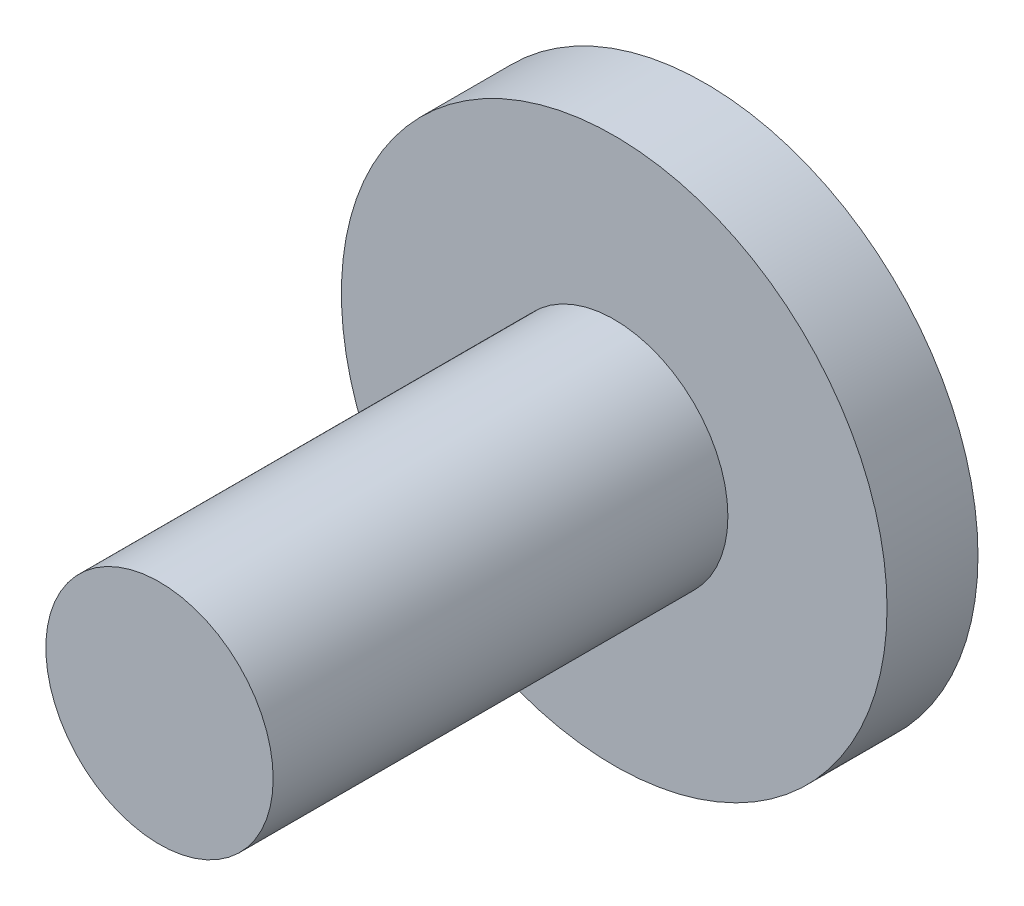
from build123d import *

# Parameters (mm, degrees)
SKETCH1_R           = 2.5
BOSS_EXTRUDE1_DEPTH = 10
SKETCH1_4_R         = 6
BOSS_EXTRUDE2_DEPTH = 2


with BuildPart() as part:
    # Sketch1 → Boss-Extrude1 (new body)
    with BuildSketch(Plane.XY):
        Circle(SKETCH1_R)
    extrude(amount=BOSS_EXTRUDE1_DEPTH)


with BuildPart() as body_2:
    # Sketch1<4> → Boss-Extrude2 (new body)
    with BuildSketch(Plane.XY):
        Circle(SKETCH1_4_R)
    extrude(amount=-BOSS_EXTRUDE2_DEPTH)


solid = Compound([part.part, body_2.part])
